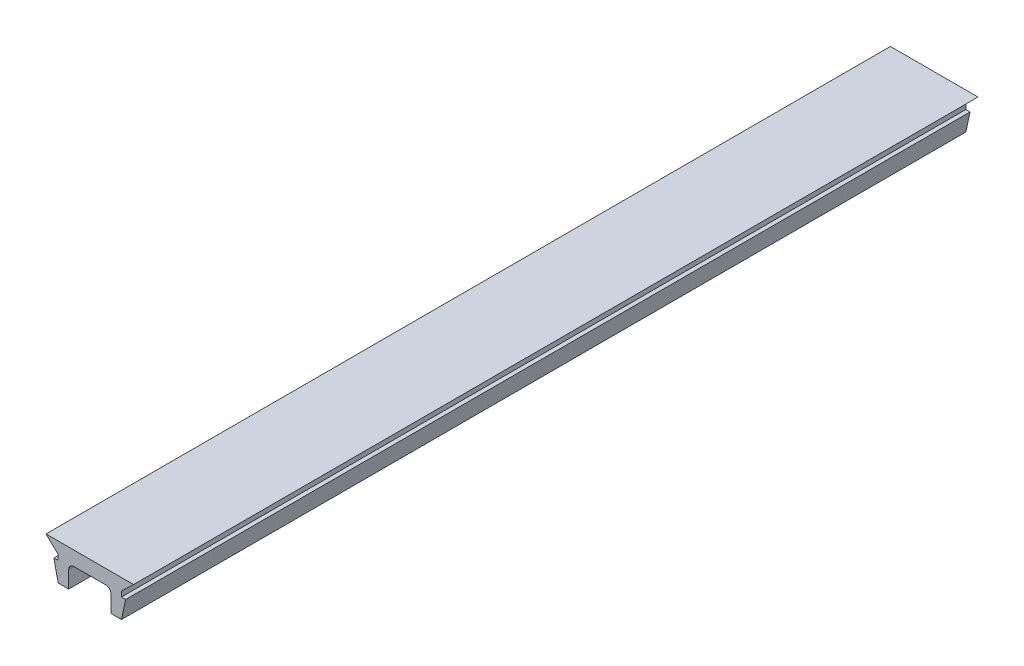
from build123d import *

# Parameters (mm, degrees)
BOSS_EXTRUDE1_DEPTH = 80


with BuildPart() as part:
    # Sketch1 → Boss-Extrude1 (new body)
    with BuildSketch(Plane.XY):
        with BuildLine():
            Line((6, 0), (6.4, 1.85))
            Line((6.4, 1.85), (6, 1.85))
            Line((6, 1.85), (6, 2.35))
            Line((6, 2.35), (7.15, 3.45))
            Line((7.15, 3.45), (6, 3.45))
            Line((6, 3.45), (0, 3.45))
            Line((0, 3.45), (-1.15, 3.45))
            Line((-1.15, 3.45), (0, 2.35))
            Line((0, 2.35), (0, 1.85))
            Line((0, 1.85), (-0.4, 1.85))
            Line((-0.4, 1.85), (0, 0))
            Line((0, 0), (1, 0))
            Line((1, 0), (1, 1.6))
            ThreePointArc((1, 1.6), (1.146446609, 1.953553391), (1.5, 2.1))
            Line((1.5, 2.1), (4.5, 2.1))
            ThreePointArc((4.5, 2.1), (4.853553391, 1.953553391), (5, 1.6))
            Line((5, 1.6), (5, 0))
            Line((5, 0), (6, 0))
        make_face()
    extrude(amount=BOSS_EXTRUDE1_DEPTH)


solid = part.part
